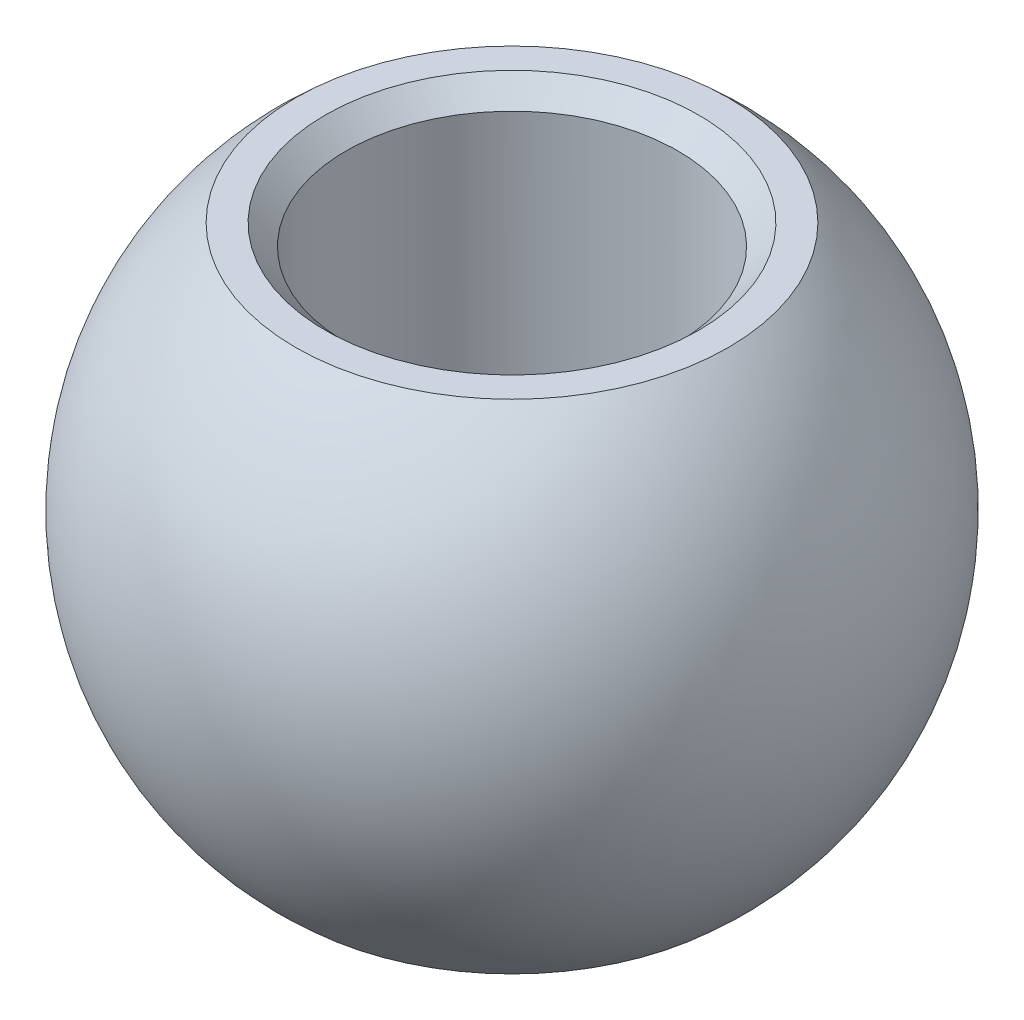
from build123d import *

# Parameters (mm, degrees)
CHAMFER1_SIZE = 0.5


with BuildPart() as part:
    # Sketch1 → Revolve1 (revolve)
    with BuildSketch(Plane.XY):
        with BuildLine():
            Line((-5.215601595, -6), (-4, -6))
            Line((-4, -6), (-4, 6))
            Line((-4, 6), (-5.215601595, 6))
            ThreePointArc((-5.215601595, 6), (-7.95, 0), (-5.215601595, -6))
        make_face()
    revolve(axis=Axis((0, -6, 0), (0, 1, 0)))

    # Chamfer1
    chamfer1_edges = [part.edges().sort_by_distance(p)[0] for p in [
        (4, 6, 0),
        (4, -6, 0),
    ]]
    chamfer(chamfer1_edges, length=CHAMFER1_SIZE)


solid = part.part
